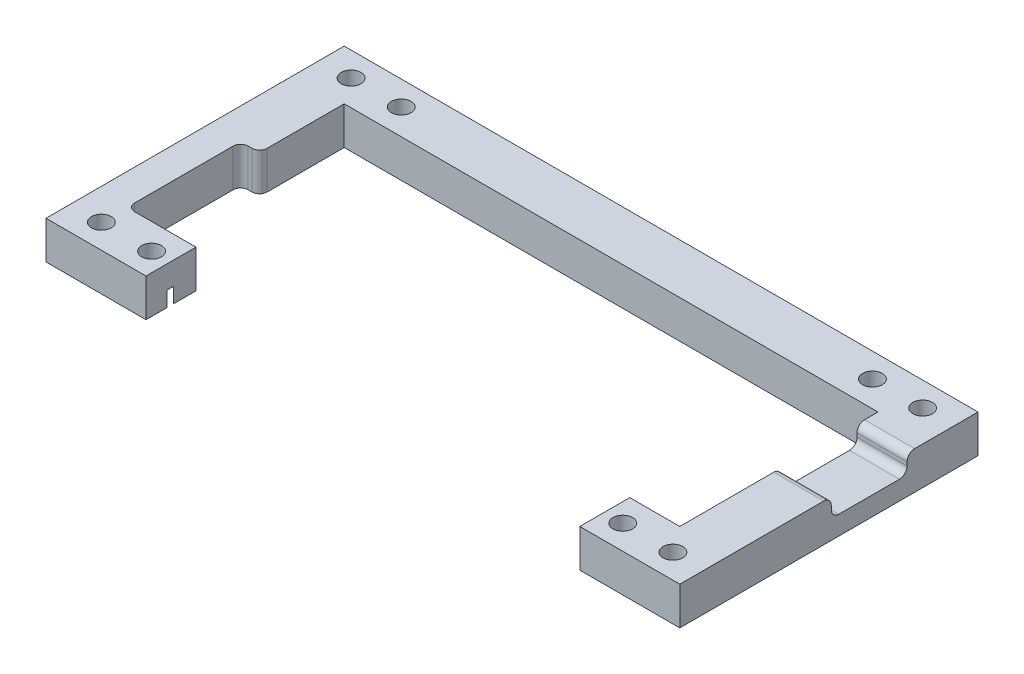
from build123d import *

# Parameters (mm, degrees)
SKETCH1_R           = 1.651
BOSS_EXTRUDE1_DEPTH = 6.35
SKETCH2_W           = 12.7
SKETCH2_H           = 3.175
CUT_EXTRUDE7_DEPTH  = 8.89
FILLET2_R           = 1.27
SKETCH4_W           = 3.175
SKETCH4_H           = 19.05
CUT_EXTRUDE8_DEPTH  = 192.82600491
FILLET3_R           = 1.27
SKETCH5_R           = 3.175
CUT_EXTRUDE9_DEPTH  = 2.54


with BuildPart() as part:
    # Sketch1 → Boss-Extrude1 (new body)
    with BuildSketch(Plane(origin=(0, 0, 0), x_dir=(1, 0, 0), z_dir=(0, 1, 0))):
        Polygon((75.155177047, 61.997896552), (75.155177047, 11.997896552), (91.919177047, 11.997896552), (91.919177047, 20.379896552), (83.537177047, 20.379896552), (83.537177047, 53.615896552), (173.037829354, 53.615896552), (173.037829354, 20.379896552), (164.655829354, 20.379896552), (164.655829354, 11.997896552), (181.419829354, 11.997896552), (181.419829354, 61.997896552), align=None)
        with Locations(Location((80.3721812, 16.064784874, 0), (0, 0, 270))):
            Circle(SKETCH1_R, mode=Mode.SUBTRACT)
        with Locations(Location((80.3721812, 57.93100823, 0), (0, 0, 270))):
            Circle(SKETCH1_R, mode=Mode.SUBTRACT)
        with Locations(Location((88.7874552, 16.064784874, 0), (0, 0, 270))):
            Circle(SKETCH1_R, mode=Mode.SUBTRACT)
        with Locations(Location((167.7875512, 57.93100823, 0), (0, 0, 270))):
            Circle(SKETCH1_R, mode=Mode.SUBTRACT)
        with Locations(Location((88.7874552, 57.93100823, 0), (0, 0, 270))):
            Circle(SKETCH1_R, mode=Mode.SUBTRACT)
        with Locations(Location((176.2028252, 57.93100823, 0), (0, 0, 270))):
            Circle(SKETCH1_R, mode=Mode.SUBTRACT)
        with Locations(Location((176.2028252, 16.064784874, 0), (0, 0, 270))):
            Circle(SKETCH1_R, mode=Mode.SUBTRACT)
        with Locations(Location((167.7875512, 16.064784874, 0), (0, 0, 270))):
            Circle(SKETCH1_R, mode=Mode.SUBTRACT)
    extrude(amount=BOSS_EXTRUDE1_DEPTH)

    # Sketch2 → Cut-Extrude7 (cut)
    with BuildSketch(Plane(origin=(181.419829354, 0, 0), x_dir=(0, 0, -1), z_dir=(1, 0, 0))):
        with Locations((43.747896552, 4.7625)):
            Rectangle(SKETCH2_W, SKETCH2_H)
    extrude(amount=-CUT_EXTRUDE7_DEPTH, mode=Mode.SUBTRACT)

    # Fillet2
    fillet2_edges = [part.edges().sort_by_distance(p)[0] for p in [
        (177.228829354, 6.35, -37.397896552),
        (177.228829354, 6.35, -50.097896552),
        (177.228829354, 3.175, -50.097896552),
        (177.228829354, 3.175, -37.397896552),
    ]]
    fillet(fillet2_edges, radius=FILLET2_R)

    # Sketch4 → Cut-Extrude8 (cut, through all)
    with BuildSketch(Plane(origin=(0, 6.35, 0), x_dir=(1, 0, 0), z_dir=(0, 1, 0))):
        with Locations((81.949677047, 29.904896552)):
            Rectangle(SKETCH4_W, SKETCH4_H)
    extrude(amount=-CUT_EXTRUDE8_DEPTH, mode=Mode.SUBTRACT)

    # Fillet3
    fillet3_edges = [part.edges().sort_by_distance(p)[0] for p in [
        (83.537177047, 3.175, -39.429896552),
        (80.362177047, 3.175, -20.379896552),
        (80.362177047, 3.175, -39.429896552),
    ]]
    fillet(fillet3_edges, radius=FILLET3_R)

    # Sketch5 → Cut-Extrude9 (cut)
    with BuildSketch(Plane.XZ):
        with Locations((88.7874552, -16.064784874)):
            Circle(SKETCH5_R)
        with Locations(Location((88.7874552, -57.93100823, 0), (0, 0, 270))):
            Circle(SKETCH5_R)
        with Locations(Location((167.7875512, -57.93100823, 0), (0, 0, 270))):
            Circle(SKETCH5_R)
        with Locations((167.7875512, -16.064784874)):
            Circle(SKETCH5_R)
    extrude(amount=-CUT_EXTRUDE9_DEPTH, mode=Mode.SUBTRACT)


solid = part.part
